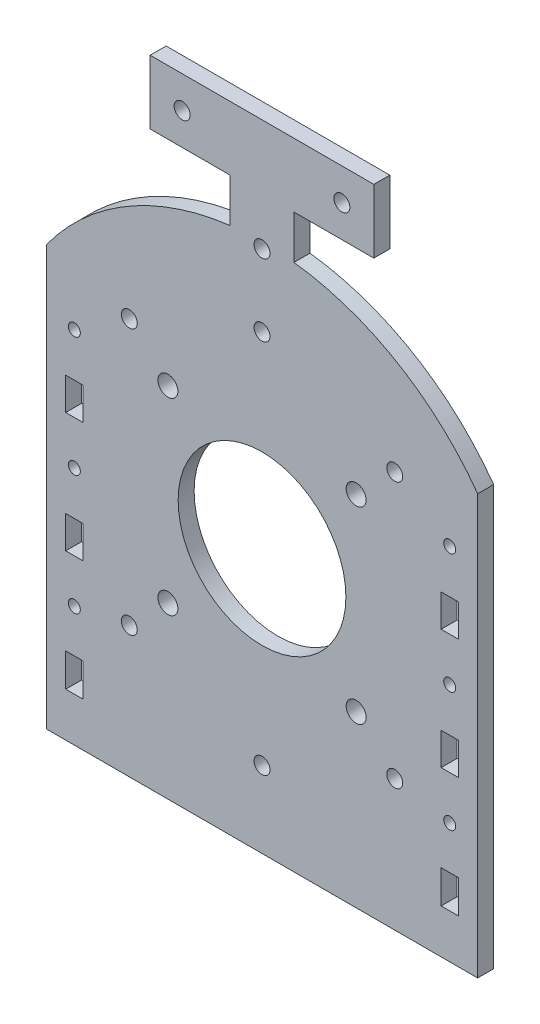
from build123d import *

# Parameters (mm, degrees)
SKETCH_1_R      = 1.5
SKETCH_1_R_2    = 2.5
SKETCH_1_R_3    = 21
SKETCH_1_R_4    = 2
SKETCH_1_W      = 4.3
SKETCH_1_H      = 8.1
SKETCH_1_H_2    = 8.3
EXTRUDE_1_DEPTH = 4


with BuildPart() as part:
    # 草图1 → 凸台-拉伸1 (new body)
    with BuildSketch(Plane.XY):
        with BuildLine():
            Line((-54, 52.4), (-54, -52.6))
            Line((-54, -52.6), (54, -52.6))
            Line((54, -52.6), (54, 52.4))
            ThreePointArc((54, 52.4), (33.845954515, 70.803240423), (8, 79.569735886))
            Line((8, 79.569735886), (8, 90.5))
            Line((8, 90.5), (28, 90.5))
            Line((28, 90.5), (28, 106.5))
            Line((28, 106.5), (-28, 106.5))
            Line((-28, 106.5), (-28, 90.5))
            Line((-28, 90.5), (-8, 90.5))
            Line((-8, 90.5), (-8, 79.569735886))
            ThreePointArc((-8, 79.569735886), (-33.845954515, 70.803240423), (-54, 52.4))
        make_face()
        with Locations((-47, 37.5)):
            Circle(SKETCH_1_R, mode=Mode.SUBTRACT)
        with Locations((-47, 7.5)):
            Circle(SKETCH_1_R, mode=Mode.SUBTRACT)
        with Locations((-47, -22.5)):
            Circle(SKETCH_1_R, mode=Mode.SUBTRACT)
        with Locations((-23.57, 37.07)):
            Circle(SKETCH_1_R_2, mode=Mode.SUBTRACT)
        with Locations((-23.57, -10.07)):
            Circle(SKETCH_1_R_2, mode=Mode.SUBTRACT)
        with Locations((23.57, -10.07)):
            Circle(SKETCH_1_R_2, mode=Mode.SUBTRACT)
        with Locations((23.57, 37.07)):
            Circle(SKETCH_1_R_2, mode=Mode.SUBTRACT)
        with Locations((47, -22.5)):
            Circle(SKETCH_1_R, mode=Mode.SUBTRACT)
        with Locations((47, 7.5)):
            Circle(SKETCH_1_R, mode=Mode.SUBTRACT)
        with Locations((47, 37.5)):
            Circle(SKETCH_1_R, mode=Mode.SUBTRACT)
        with Locations((0, 13.5)):
            Circle(SKETCH_1_R_3, mode=Mode.SUBTRACT)
        with Locations((0, 60.5)):
            Circle(SKETCH_1_R_4, mode=Mode.SUBTRACT)
        with Locations((33.234018716, 46.734018716)):
            Circle(SKETCH_1_R_4, mode=Mode.SUBTRACT)
        with Locations((33.234018716, -19.734018716)):
            Circle(SKETCH_1_R_4, mode=Mode.SUBTRACT)
        with Locations((0, -33.5)):
            Circle(SKETCH_1_R_4, mode=Mode.SUBTRACT)
        with Locations((-33.234018716, -19.734018716)):
            Circle(SKETCH_1_R_4, mode=Mode.SUBTRACT)
        with Locations((-33.234018716, 46.734018716)):
            Circle(SKETCH_1_R_4, mode=Mode.SUBTRACT)
        with Locations((0, 78.5)):
            Circle(SKETCH_1_R_4, mode=Mode.SUBTRACT)
        with Locations((-20, 98.5)):
            Circle(SKETCH_1_R_4, mode=Mode.SUBTRACT)
        with Locations((20, 98.5)):
            Circle(SKETCH_1_R_4, mode=Mode.SUBTRACT)
        with Locations((-47, 22.5)):
            Rectangle(SKETCH_1_W, SKETCH_1_H, mode=Mode.SUBTRACT)
        with Locations((-47, -7.5)):
            Rectangle(SKETCH_1_W, SKETCH_1_H, mode=Mode.SUBTRACT)
        with Locations((-47, -37.4)):
            Rectangle(SKETCH_1_W, SKETCH_1_H_2, mode=Mode.SUBTRACT)
        with Locations((47, -37.4)):
            Rectangle(SKETCH_1_W, SKETCH_1_H_2, mode=Mode.SUBTRACT)
        with Locations((47, -7.5)):
            Rectangle(SKETCH_1_W, SKETCH_1_H, mode=Mode.SUBTRACT)
        with Locations((47, 22.5)):
            Rectangle(SKETCH_1_W, SKETCH_1_H, mode=Mode.SUBTRACT)
    extrude(amount=EXTRUDE_1_DEPTH)


solid = part.part
